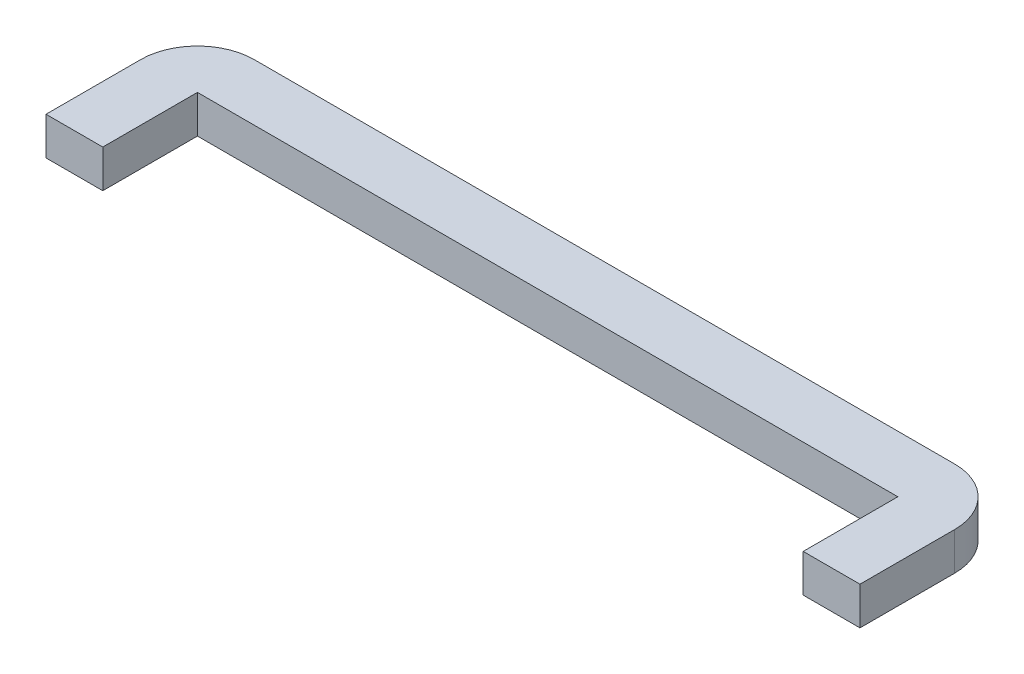
from build123d import *

# Parameters (mm, degrees)
SKETCH1_W           = 43
SKETCH1_H           = 3
SKETCH1_W_2         = 3
SKETCH1_H_2         = 5
BOSS_EXTRUDE1_DEPTH = 1
FILLET1_R           = 3


with BuildPart() as part:
    # Sketch1 → Boss-Extrude1 (new, symmetric)
    with BuildSketch(Plane(origin=(0, 0, 0), x_dir=(1, 0, 0), z_dir=(0, 1, 0))):
        Rectangle(SKETCH1_W, SKETCH1_H)
        with Locations((-20, -4)):
            Rectangle(SKETCH1_W_2, SKETCH1_H_2)
        with Locations((20, -4)):
            Rectangle(SKETCH1_W_2, SKETCH1_H_2)
    extrude(amount=BOSS_EXTRUDE1_DEPTH, both=True)

    # Fillet1
    fillet1_edges = [part.edges().sort_by_distance(p)[0] for p in [
        (-21.5, 0, -1.5),
        (21.5, 0, -1.5),
    ]]
    fillet(fillet1_edges, radius=FILLET1_R)


solid = part.part
